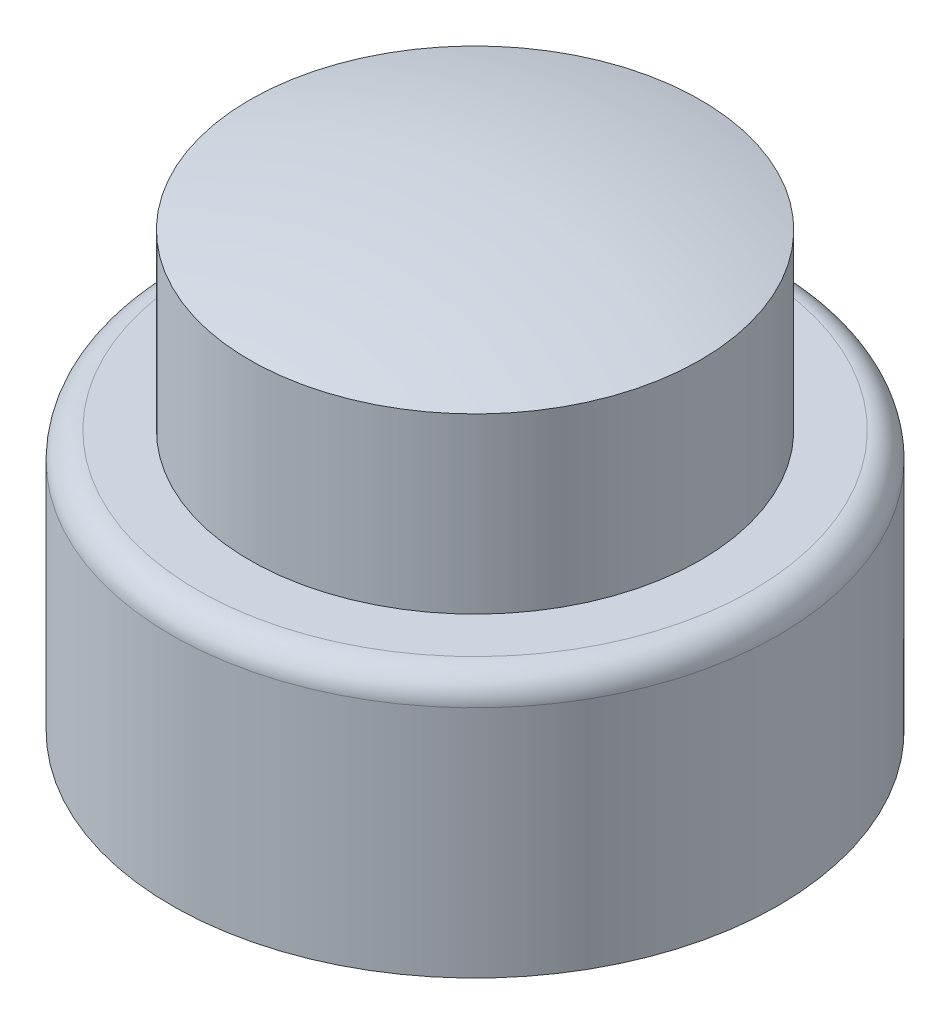
from build123d import *

# Parameters (mm, degrees)
FILLET1_R = 0.15


with BuildPart() as part:
    # Sketch1 → Revolve1 (revolve)
    with BuildSketch(Plane.XY, mode=Mode.PRIVATE) as revolve1_sk:
        with BuildLine():
            Line((-1.3, 2.5), (-1.3, 1.5))
            Line((-1.3, 1.5), (-1.75, 1.5))
            Line((-1.75, 1.5), (-1.75, 0))
            Line((-1.75, 0), (0, 0))
            Line((0, 0), (0, 2.671956918))
            ThreePointArc((0, 2.671956918), (-0.655661723, 2.628781275), (-1.3, 2.5))
        make_face()
    revolve(revolve1_sk.sketch.rotate(Axis((0, 0, 0), (0, 1, 0)), 180), axis=Axis((0, 0, 0), (0, 1, 0)))

    # Fillet1
    fillet1_edges = [part.edges().sort_by_distance(p)[0] for p in [
        (-1.75, 1.5, 0),
    ]]
    fillet(fillet1_edges, radius=FILLET1_R)


solid = part.part
